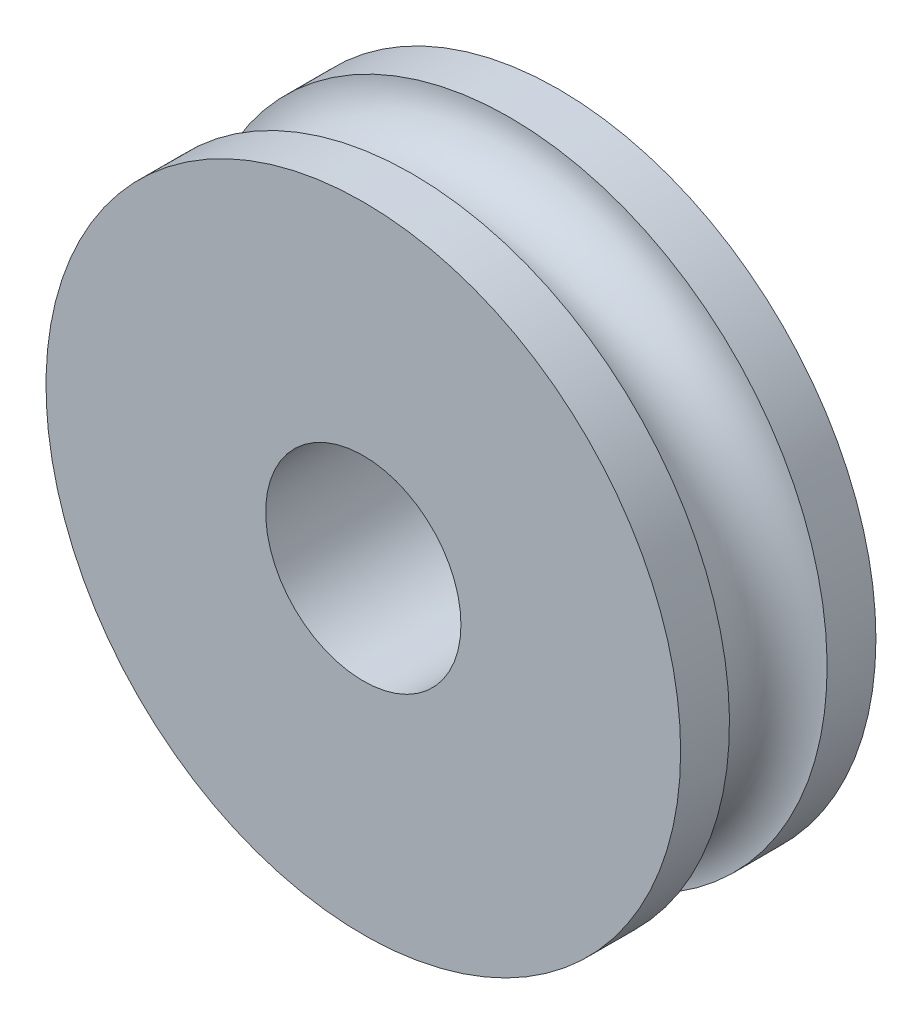
from build123d import *

# Parameters (mm, degrees)
SKETCH1_R           = 6.5
BOSS_EXTRUDE1_DEPTH = 4
SKETCH2_R           = 2
CUT_EXTRUDE1_DEPTH  = 11.024968828
SKETCH4_R           = 1


with BuildPart() as part:
    # Sketch1 → Boss-Extrude1 (new body)
    with BuildSketch(Plane.XY):
        Circle(SKETCH1_R)
    extrude(amount=BOSS_EXTRUDE1_DEPTH)

    # Sketch2 → Cut-Extrude1 (cut, through all)
    with BuildSketch(Plane.XY.offset(4)):
        Circle(SKETCH2_R)
    extrude(amount=-CUT_EXTRUDE1_DEPTH, mode=Mode.SUBTRACT)

    # Cut-Sweep1: sweep along a path in Sketch3
    with BuildLine(Plane.XY.offset(2)) as cut_sweep1_path:
        CenterArc((0, 0), 6.5, 0, 360)
    # Sketch4 → Cut-Sweep1 (sweep, cut)
    with BuildSketch(Plane(origin=(0, 0, 0), x_dir=(0, 0, -1), z_dir=(1, 0, 0))):
        with Locations((-2, 6.5)):
            Circle(SKETCH4_R)
    sweep(path=cut_sweep1_path.line, mode=Mode.SUBTRACT)


solid = part.part
